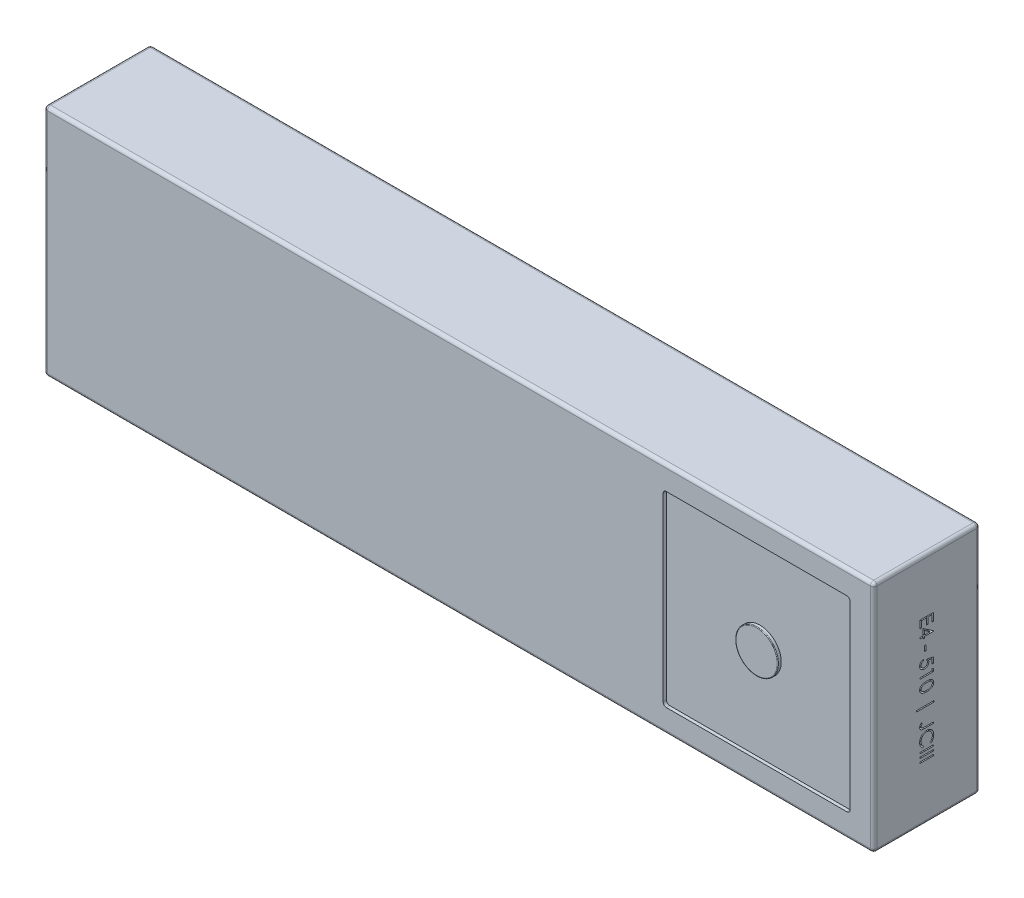
from build123d import *

# Parameters (mm, degrees)
SKETCH1_W           = 123.825
SKETCH1_H           = 34.925
BOSS_EXTRUDE1_DEPTH = 7.9375
FILLET1_R           = 0.5
SKETCH2_W           = 27.925
SKETCH2_H           = 27.925
CUT_EXTRUDE1_DEPTH  = 0.5
SKETCH3_R           = 3.175
BOSS_EXTRUDE2_DEPTH = 0.5
FILLET2_R           = 0.5
FILLET3_R           = 0.1
SKETCH4_W           = 0.205128205
SKETCH4_H           = 0.769230769
SKETCH4_W_2         = 2.58974359
SKETCH4_H_2         = 0.179487179
SKETCH4_W_3         = 2
SKETCH4_H_3         = 0.17948718
CUT_EXTRUDE2_DEPTH  = 1


with BuildPart() as part:
    # Sketch1 → Boss-Extrude1 (new, symmetric)
    with BuildSketch(Plane.XY):
        Rectangle(SKETCH1_W, SKETCH1_H)
    extrude(amount=BOSS_EXTRUDE1_DEPTH, both=True)

    # Fillet1
    fillet1_edges = [part.edges().sort_by_distance(p)[0] for p in [
        (-61.9125, 0, 7.9375),
        (0, -17.4625, 7.9375),
        (61.9125, 0, 7.9375),
        (0, -17.4625, -7.9375),
        (-61.9125, 0, -7.9375),
        (0, 17.4625, -7.9375),
        (61.9125, 0, -7.9375),
        (61.9125, -17.4625, 0),
        (-61.9125, -17.4625, 0),
        (-61.9125, 17.4625, 0),
        (61.9125, 17.4625, 0),
        (0, 17.4625, 7.9375),
    ]]
    fillet(fillet1_edges, radius=FILLET1_R)

    # Sketch2 → Cut-Extrude1 (cut)
    with BuildSketch(Plane.XY.offset(7.9375)):
        with Locations((44.45, 0)):
            Rectangle(SKETCH2_W, SKETCH2_H)
    extrude(amount=-CUT_EXTRUDE1_DEPTH, mode=Mode.SUBTRACT)

    # Sketch3 → Boss-Extrude2 (add)
    with BuildSketch(Plane.XY.offset(7.4375)):
        with Locations((44.45, 0)):
            Circle(SKETCH3_R)
    extrude(amount=BOSS_EXTRUDE2_DEPTH)

    # Fillet2
    fillet2_edges = [part.edges().sort_by_distance(p)[0] for p in [
        (58.4125, 13.9625, 7.6875),
        (58.4125, -13.9625, 7.6875),
        (30.4875, -13.9625, 7.6875),
        (30.4875, 13.9625, 7.6875),
    ]]
    fillet(fillet2_edges, radius=FILLET2_R)

    # Fillet3
    fillet3_edges = [part.edges().sort_by_distance(p)[0] for p in [
        (41.275, 0, 7.9375),
    ]]
    fillet(fillet3_edges, radius=FILLET3_R)

    # Sketch4 → Cut-Extrude2 (cut)
    # profile 1 of 12: a face of its own
    with BuildSketch(Plane(origin=(61.9125, 0, 0), x_dir=(0, 0, -1), z_dir=(1, 0, 0))):
        Polygon((0.988986137, 9.333333333), (0.988986137, 8.205128205), (0.783857931, 8.205128205), (0.783857931, 9.153846154), (0.168473316, 9.153846154), (0.168473316, 8.205128205), (-0.036654889, 8.205128205), (-0.036654889, 9.153846154), (-0.805885658, 9.153846154), (-0.805885658, 8.205128205), (-1.011013863, 8.205128205), (-1.011013863, 9.333333333), align=None)
    # profile 2 of 12: a face of its own
    with BuildSketch(Plane(origin=(61.9125, 0, 0), x_dir=(0, 0, -1), z_dir=(1, 0, 0))):
        Polygon((1.040268188, 6.933894231), (1.040268188, 6.897435897), (-0.344347197, 6.897435897), (-0.344347197, 6.666666667), (-0.549475402, 6.666666667), (-0.549475402, 6.897435897), (-1.011013863, 6.897435897), (-1.011013863, 7.076923077), (-0.549475402, 7.076923077), (-0.549475402, 8.025641026), align=None)
        Polygon((-0.344347197, 7.076923077), (0.524242547, 7.076923077), (-0.344347197, 7.673076923), align=None, mode=Mode.SUBTRACT)
    # profile 3 of 12: a face of its own
    with BuildSketch(Plane(origin=(61.9125, 0, 0), x_dir=(0, 0, -1), z_dir=(1, 0, 0))):
        with Locations((-0.241783095, 5.333333334)):
            Rectangle(SKETCH4_W, SKETCH4_H)
    # profile 4 of 12: a face of its own
    with BuildSketch(Plane(origin=(61.9125, 0, 0), x_dir=(0, 0, -1), z_dir=(1, 0, 0))):
        with BuildLine():
            Line((0.988986137, 2.769230769), (0.783857931, 2.769230769))
            Line((0.783857931, 2.769230769), (0.783857931, 3.449519231))
            Line((0.783857931, 3.449519231), (0.257816265, 3.557291667))
            add(Edge.make_bspline(
                [(0.257816265, 3.557291667), (0.263662134, 3.536116881), (0.274987582, 3.495094084), (0.287562308, 3.434545592), (0.295142562, 3.377064333), (0.296177596, 3.339764121), (0.296678444, 3.321714744)],
                knots=[0, 0, 0, 0, 1.100273476, 2.13160584, 3.095893838, 4, 4, 4, 4], degree=3))
            add(Edge.make_bspline(
                [(0.296678444, 3.321714744), (0.296194926, 3.299381255), (0.295244208, 3.255468037), (0.286119235, 3.191216115), (0.27174704, 3.12988701), (0.251701868, 3.071585506), (0.225903999, 3.016186028), (0.194095766, 2.963997951), (0.156497184, 2.914725508), (0.113471016, 2.869020059), (0.066059037, 2.827620389), (0.015248206, 2.791076771), (-0.039007694, 2.760684274), (-0.096468747, 2.735679911), (-0.157038541, 2.715841364), (-0.221165411, 2.702601029), (-0.288280291, 2.693794419), (-0.334168385, 2.69280979), (-0.357568351, 2.692307692)],
                knots=[0, 0, 0, 0, 1.052772836, 2.070014431, 3.053871312, 4.019926262, 4.972333346, 5.930471369, 6.896690565, 7.89035727, 8.885779078, 9.861050232, 10.836829716, 11.812751485, 12.812646763, 13.836748493, 14.896881366, 16, 16, 16, 16], degree=3))
            add(Edge.make_bspline(
                [(-0.357568351, 2.692307692), (-0.373866784, 2.692687684), (-0.40624339, 2.693442533), (-0.454325477, 2.697282476), (-0.501391119, 2.704671522), (-0.547439612, 2.714606238), (-0.592409391, 2.727449664), (-0.636284101, 2.743166409), (-0.679198838, 2.761692576), (-0.721156413, 2.782609059), (-0.760863342, 2.806805552), (-0.79893256, 2.832293734), (-0.83396304, 2.860527624), (-0.867233628, 2.890140277), (-0.897437736, 2.922315781), (-0.925867928, 2.956055461), (-0.951289255, 2.992151102), (-0.974671136, 3.029956458), (-0.995606365, 3.069447689), (-1.013070086, 3.111025229), (-1.028377187, 3.153776342), (-1.040825004, 3.198082064), (-1.05048271, 3.243856561), (-1.057059477, 3.291257461), (-1.061844647, 3.340046915), (-1.062144466, 3.373118283), (-1.062295915, 3.389823718)],
                knots=[0, 0, 0, 0, 1.05623316, 2.098192244, 3.122504159, 4.140841222, 5.148757784, 6.150489607, 7.158294732, 8.176043417, 9.185147859, 10.169157858, 11.142149047, 12.097904048, 13.0527185, 13.998867679, 14.954465986, 15.910220987, 16.877849176, 17.847023716, 18.829548819, 19.818454515, 20.826519638, 21.858115382, 22.918063636, 24, 24, 24, 24], degree=3))
            add(Edge.make_bspline(
                [(-1.062295915, 3.389823718), (-1.061901116, 3.409751797), (-1.061124395, 3.448957938), (-1.053000039, 3.50639861), (-1.041361715, 3.561662829), (-1.023861835, 3.614313228), (-1.001902032, 3.664794019), (-0.974324358, 3.712433206), (-0.942636356, 3.75816716), (-0.905744682, 3.800752886), (-0.865043564, 3.84019738), (-0.82134845, 3.876048998), (-0.774485602, 3.907490653), (-0.724853979, 3.934650655), (-0.672368182, 3.957784281), (-0.616871155, 3.975966509), (-0.558642079, 3.990639242), (-0.518554428, 3.996846996), (-0.498193351, 4)],
                knots=[0, 0, 0, 0, 1.046825758, 2.059506013, 3.044032586, 4.011925612, 4.970610144, 5.93275819, 6.900651216, 7.891265644, 8.889116719, 9.876966323, 10.858259055, 11.851035124, 12.847502422, 13.86866322, 14.9174643, 16, 16, 16, 16], degree=3))
            Line((-0.498193351, 4), (-0.498193351, 3.820512821))
            add(Edge.make_bspline(
                [(-0.498193351, 3.820512821), (-0.517267429, 3.816099281), (-0.553928866, 3.807616214), (-0.605408274, 3.78894737), (-0.651456097, 3.766261983), (-0.692115806, 3.738672926), (-0.727758373, 3.706428015), (-0.759795221, 3.6698973), (-0.788314786, 3.628560354), (-0.812240258, 3.582643529), (-0.832615064, 3.534172832), (-0.846189415, 3.483450331), (-0.855732272, 3.431847424), (-0.856687632, 3.396945555), (-0.85716771, 3.379407051)],
                knots=[0, 0, 0, 0, 1.136389429, 2.184203582, 3.172920998, 4.111012962, 5.028380909, 5.957351669, 6.927793475, 7.937618031, 8.960409703, 9.974842029, 10.982339866, 12, 12, 12, 12], degree=3))
            add(Edge.make_bspline(
                [(-0.85716771, 3.379407051), (-0.856698694, 3.36228794), (-0.855775197, 3.32858027), (-0.848667191, 3.278973764), (-0.837720007, 3.231080693), (-0.821337233, 3.185373632), (-0.801425965, 3.141052752), (-0.775874493, 3.099239169), (-0.746468768, 3.058723239), (-0.712779265, 3.020764306), (-0.675653726, 2.985998906), (-0.635952358, 2.955281123), (-0.593599874, 2.929694315), (-0.549329501, 2.908131967), (-0.50265604, 2.891758653), (-0.453798225, 2.880078093), (-0.40263538, 2.873219202), (-0.367738631, 2.87227567), (-0.349956171, 2.871794872)],
                knots=[0, 0, 0, 0, 1.027316725, 2.022795036, 3.002884548, 3.971462791, 4.93288096, 5.914575861, 6.907176829, 7.935150275, 8.956128384, 9.956726525, 10.942570165, 11.921478529, 12.907843606, 13.90538589, 14.932640048, 16, 16, 16, 16], degree=3))
            add(Edge.make_bspline(
                [(-0.349956171, 2.871794872), (-0.333903218, 2.87211054), (-0.302463838, 2.872728771), (-0.256670028, 2.879598827), (-0.21302586, 2.889222709), (-0.17192163, 2.903998953), (-0.132755426, 2.922256256), (-0.096365548, 2.945419161), (-0.061817077, 2.971896748), (-0.03051353, 3.002909326), (-0.00142681, 3.036727224), (0.023332475, 3.07413547), (0.044171364, 3.114280811), (0.062152424, 3.156698605), (0.075067318, 3.202392587), (0.084763201, 3.250459304), (0.090371994, 3.301417403), (0.091150214, 3.336257799), (0.091550239, 3.354166667)],
                knots=[0, 0, 0, 0, 1.045726679, 2.048034203, 3.01323695, 3.95502507, 4.889743367, 5.8246644, 6.761650845, 7.722168973, 8.692072792, 9.66525385, 10.638902184, 11.638179751, 12.663148338, 13.728659964, 14.832472288, 16, 16, 16, 16], degree=3))
            add(Edge.make_bspline(
                [(0.091550239, 3.354166667), (0.091229739, 3.369803537), (0.090573625, 3.401814638), (0.085410143, 3.451031651), (0.077466623, 3.502526279), (0.066017475, 3.556498442), (0.051682354, 3.612800022), (0.033779586, 3.671524649), (0.013157854, 3.732673742), (-0.002837064, 3.773831461), (-0.011013863, 3.794871795)],
                knots=[0, 0, 0, 0, 0.824638674, 1.688163388, 2.607705698, 3.571998603, 4.597075385, 5.671199175, 6.809488238, 8, 8, 8, 8], degree=3))
            Line((-0.011013863, 3.794871795), (0.988986137, 3.58974359))
            Line((0.988986137, 3.58974359), (0.988986137, 2.769230769))
        make_face()
    # profile 5 of 12: a face of its own
    with BuildSketch(Plane(origin=(61.9125, 0, 0), x_dir=(0, 0, -1), z_dir=(1, 0, 0))):
        Polygon((0.988986137, 2.062099359), (0.988986137, 1.692307692), (-1.011013863, 1.692307692), (-1.011013863, 1.871794872), (0.783857931, 1.871794872), (0.783857931, 2.179487179), align=None)
    # profile 6 of 12: a face of its own
    with BuildSketch(Plane(origin=(61.9125, 0, 0), x_dir=(0, 0, -1), z_dir=(1, 0, 0))):
        with BuildLine():
            add(Edge.make_bspline(
                [(-0.011815145, 0.948717949), (0.020240505, 0.94853051), (0.082509067, 0.948166407), (0.173243148, 0.944115881), (0.258363314, 0.937387114), (0.337873636, 0.928165757), (0.411794649, 0.916944059), (0.47992878, 0.901963764), (0.542591463, 0.884927932), (0.59998675, 0.865183491), (0.652888879, 0.842905395), (0.702272645, 0.81865499), (0.748075352, 0.791483107), (0.790985077, 0.762896272), (0.830522928, 0.731849846), (0.866614029, 0.698671292), (0.899280175, 0.663031492), (0.928910146, 0.62563532), (0.954721628, 0.586246443), (0.977979489, 0.546079089), (0.997068637, 0.504424472), (1.012753792, 0.461662496), (1.025321908, 0.417917516), (1.034025305, 0.373008782), (1.039479994, 0.326925445), (1.040002964, 0.295822117), (1.040268188, 0.280048077)],
                knots=[0, 0, 0, 0, 1.646377244, 3.198111528, 4.663803227, 6.031090796, 7.308794487, 8.502186765, 9.612154809, 10.642545331, 11.617106989, 12.558866172, 13.465886467, 14.35053239, 15.20542558, 16.045215227, 16.865619885, 17.686225247, 18.492864914, 19.282407821, 20.068097601, 20.842842034, 21.620163247, 22.403093475, 23.190129512, 24, 24, 24, 24], degree=3))
            add(Edge.make_bspline(
                [(1.040268188, 0.280048077), (1.039989436, 0.264142089), (1.039435087, 0.232510084), (1.03410712, 0.185744155), (1.025266478, 0.140058623), (1.012740207, 0.095648258), (0.99719982, 0.052148266), (0.977721468, 0.00989889), (0.955047829, -0.0313623), (0.928405614, -0.070979607), (0.898701456, -0.109387958), (0.865122788, -0.145643937), (0.828008663, -0.179750843), (0.787756169, -0.212136732), (0.743593263, -0.241882788), (0.696288058, -0.270210463), (0.645013278, -0.295565912), (0.590624439, -0.319985727), (0.531616634, -0.341064005), (0.468322485, -0.360073288), (0.399994379, -0.375432699), (0.32699081, -0.388226568), (0.249043676, -0.398137938), (0.166320068, -0.40535659), (0.078765559, -0.409169782), (0.018903931, -0.409887897), (-0.011815145, -0.41025641)],
                knots=[0, 0, 0, 0, 0.810914788, 1.612654377, 2.396697861, 3.181598691, 3.963628158, 4.749916497, 5.551656086, 6.361998678, 7.18212741, 8.025565596, 8.878627764, 9.750805457, 10.657531673, 11.591944965, 12.560506719, 13.57287815, 14.630710178, 15.753379473, 16.941251878, 18.199788006, 19.531962791, 20.947069417, 22.433333509, 24, 24, 24, 24], degree=3))
            add(Edge.make_bspline(
                [(-0.011815145, -0.41025641), (-0.042400121, -0.409883616), (-0.1019937, -0.409157242), (-0.189155837, -0.405404339), (-0.271434882, -0.39797707), (-0.349059869, -0.38879071), (-0.421569914, -0.375704868), (-0.489654498, -0.360828571), (-0.552726063, -0.342338932), (-0.611422666, -0.321547951), (-0.665545034, -0.297658023), (-0.716376568, -0.272078478), (-0.763643174, -0.243924684), (-0.807805438, -0.21400123), (-0.848407025, -0.181890617), (-0.885548282, -0.147639288), (-0.919204709, -0.111221172), (-0.949314719, -0.072725984), (-0.9756468, -0.03248544), (-0.999183446, 0.008638024), (-1.018281974, 0.051465198), (-1.034407232, 0.095044282), (-1.04696232, 0.139786472), (-1.055558704, 0.185647883), (-1.061604386, 0.23247832), (-1.062064607, 0.264136586), (-1.062295915, 0.280048077)],
                knots=[0, 0, 0, 0, 1.56130642, 3.042141888, 4.451772327, 5.777565838, 7.030558081, 8.211376819, 9.333164717, 10.383253789, 11.387583522, 12.350962576, 13.286244149, 14.193812918, 15.072134482, 15.925989337, 16.770211267, 17.600669898, 18.417446232, 19.22325363, 20.01647746, 20.807971184, 21.593601364, 22.38506573, 23.188331689, 24, 24, 24, 24], degree=3))
            add(Edge.make_bspline(
                [(-1.062295915, 0.280048077), (-1.062028139, 0.295821476), (-1.061500137, 0.32692354), (-1.056082311, 0.373016134), (-1.047247664, 0.417854828), (-1.035250256, 0.461529259), (-1.020002263, 0.504128806), (-1.00060738, 0.545236166), (-0.978112333, 0.585394226), (-0.952520007, 0.624419742), (-0.923191869, 0.661568912), (-0.890755818, 0.697054578), (-0.854398294, 0.729980742), (-0.814701254, 0.760638058), (-0.772001528, 0.789730186), (-0.72587849, 0.816635804), (-0.676032028, 0.840838907), (-0.622837862, 0.863616275), (-0.565020749, 0.883694481), (-0.502023849, 0.901296177), (-0.433498678, 0.915969652), (-0.359648667, 0.927770137), (-0.280418543, 0.937498449), (-0.195668804, 0.944084019), (-0.105472572, 0.948169633), (-0.043603984, 0.948531841), (-0.011815145, 0.948717949)],
                knots=[0, 0, 0, 0, 0.810940842, 1.599017053, 2.38298203, 3.159479784, 3.926441347, 4.70693857, 5.494146311, 6.292334103, 7.104379492, 7.925868426, 8.762126819, 9.623561095, 10.503686106, 11.41783325, 12.366995289, 13.351843594, 14.392337808, 15.512229747, 16.713911458, 17.994391108, 19.357476964, 20.818259213, 22.365182633, 24, 24, 24, 24], degree=3))
        make_face()
        with BuildLine():
            add(Edge.make_bspline(
                [(-0.011013863, 0.769230769), (-0.037727406, 0.769162514), (-0.089573146, 0.769030043), (-0.164912152, 0.765569357), (-0.235180911, 0.760854939), (-0.300468645, 0.754774196), (-0.360554371, 0.745743946), (-0.415851317, 0.735625763), (-0.466066934, 0.723312628), (-0.51154551, 0.708743853), (-0.553059852, 0.69215074), (-0.591687059, 0.67403081), (-0.627895453, 0.654575658), (-0.661317275, 0.63276437), (-0.692285216, 0.609091672), (-0.720710283, 0.583518693), (-0.746468451, 0.556090407), (-0.777033014, 0.518120669), (-0.808991019, 0.468240401), (-0.836477343, 0.405070781), (-0.853862531, 0.340132846), (-0.856067261, 0.296044381), (-0.85716771, 0.274038462)],
                knots=[0, 0, 0, 0, 1.459116078, 2.831857795, 4.118796693, 5.306371758, 6.412361096, 7.436813035, 8.376339383, 9.234574298, 10.043323891, 10.816788787, 11.564361537, 12.286735248, 12.994408768, 13.691741332, 14.372975427, 15.047457468, 16.352811911, 17.594285292, 18.799233213, 20, 20, 20, 20], degree=3))
            add(Edge.make_bspline(
                [(-0.85716771, 0.274038462), (-0.856254692, 0.251891221), (-0.854430542, 0.207642464), (-0.836831263, 0.142994582), (-0.810277241, 0.080234427), (-0.778878666, 0.031050461), (-0.748976764, -0.006368135), (-0.723482679, -0.033177844), (-0.694936469, -0.057784728), (-0.664136871, -0.081123057), (-0.630495452, -0.102528243), (-0.59417398, -0.121992893), (-0.555071593, -0.139754806), (-0.527774599, -0.149874261), (-0.513818351, -0.155048077)],
                knots=[0, 0, 0, 0, 1.353760809, 2.704726607, 4.075137775, 5.516104923, 6.260822281, 7.007110065, 7.778089737, 8.566572457, 9.372053459, 10.217411131, 11.088608312, 12, 12, 12, 12], degree=3))
            add(Edge.make_bspline(
                [(-0.513818351, -0.155048077), (-0.495972785, -0.161077659), (-0.459738634, -0.173320295), (-0.403530833, -0.189098452), (-0.344557825, -0.201524394), (-0.283172044, -0.21270346), (-0.218920786, -0.220333778), (-0.152002853, -0.226475386), (-0.082367789, -0.230092921), (-0.035056365, -0.23054135), (-0.011013863, -0.230769231)],
                knots=[0, 0, 0, 0, 0.884706709, 1.796334032, 2.740027952, 3.714592787, 4.726048262, 5.777819803, 6.87074269, 8, 8, 8, 8], degree=3))
            add(Edge.make_bspline(
                [(-0.011013863, -0.230769231), (0.013028121, -0.230517903), (0.060065201, -0.230026191), (0.128880491, -0.226795597), (0.194354401, -0.221604303), (0.256546326, -0.214577999), (0.315345572, -0.20493237), (0.37083628, -0.193348929), (0.423003491, -0.179768675), (0.471981738, -0.164191717), (0.517594982, -0.146636702), (0.559942531, -0.127243674), (0.599248886, -0.106548686), (0.635401224, -0.084066613), (0.668562727, -0.06006928), (0.698068197, -0.033922058), (0.724832182, -0.006662429), (0.755382221, 0.031518824), (0.786531761, 0.08150413), (0.81519791, 0.143701644), (0.831659791, 0.208427726), (0.833980755, 0.252183986), (0.835139983, 0.274038462)],
                knots=[0, 0, 0, 0, 1.313668642, 2.570134578, 3.763346207, 4.902004944, 5.98888779, 7.017888835, 7.998425394, 8.933058446, 9.82474457, 10.667209444, 11.476765193, 12.250262638, 12.991704352, 13.7104269, 14.401925311, 15.076585796, 16.378385137, 17.609787933, 18.806186071, 20, 20, 20, 20], degree=3))
            add(Edge.make_bspline(
                [(0.835139983, 0.274038462), (0.833980652, 0.296159729), (0.831659877, 0.340442563), (0.815241077, 0.405827324), (0.78679865, 0.468467899), (0.755181067, 0.518052178), (0.725373004, 0.556185259), (0.699451799, 0.583112537), (0.670940741, 0.608286739), (0.64010391, 0.631979159), (0.606665232, 0.65376945), (0.570462104, 0.673232564), (0.531831307, 0.691342093), (0.49032641, 0.707970831), (0.444779272, 0.72240459), (0.394817089, 0.735305709), (0.339468493, 0.745417753), (0.279214784, 0.75424195), (0.213846791, 0.760969901), (0.143416028, 0.765557255), (0.067946737, 0.769036305), (0.015833495, 0.76916465), (-0.011013863, 0.769230769)],
                knots=[0, 0, 0, 0, 1.207964612, 2.418129846, 3.655795183, 4.951004962, 5.620895151, 6.296795572, 6.989224116, 7.696855977, 8.419187164, 9.166715907, 9.940135271, 10.748837255, 11.607021648, 12.548275234, 13.5654991, 14.678641405, 15.874140913, 17.15372626, 18.533675393, 20, 20, 20, 20], degree=3))
        make_face(mode=Mode.SUBTRACT)
    # profile 7 of 12: a face of its own
    with BuildSketch(Plane(origin=(61.9125, 0, 0), x_dir=(0, 0, -1), z_dir=(1, 0, 0))):
        with Locations((-0.254603607, -2.192307693)):
            Rectangle(SKETCH4_W_2, SKETCH4_H_2)
    # profile 8 of 12: a face of its own
    with BuildSketch(Plane(origin=(61.9125, 0, 0), x_dir=(0, 0, -1), z_dir=(1, 0, 0))):
        with BuildLine():
            Line((0.988986137, -4.820512821), (0.988986137, -5))
            Line((0.988986137, -5), (-0.361574761, -5))
            add(Edge.make_bspline(
                [(-0.361574761, -5), (-0.386549339, -4.999822127), (-0.434503578, -4.99948059), (-0.503571805, -4.997566764), (-0.566649334, -4.99412817), (-0.623815286, -4.988810649), (-0.675059516, -4.982684243), (-0.720552475, -4.974736605), (-0.760068233, -4.965339194), (-0.80441841, -4.951103708), (-0.853219088, -4.92789131), (-0.905502207, -4.892301138), (-0.951609145, -4.848820782), (-0.991500093, -4.798326393), (-1.023311114, -4.740541665), (-1.046140722, -4.676596995), (-1.060067465, -4.606902596), (-1.061538191, -4.558560077), (-1.062295915, -4.533653846)],
                knots=[0, 0, 0, 0, 1.237549021, 2.376245131, 3.423509879, 4.367128923, 5.220764738, 5.980167839, 6.654279555, 7.23186528, 8.285695362, 9.319068926, 10.353713031, 11.414109097, 12.495220016, 13.606748513, 14.766988686, 16, 16, 16, 16], degree=3))
            add(Edge.make_bspline(
                [(-1.062295915, -4.533653846), (-1.06169832, -4.514112284), (-1.060504082, -4.475060261), (-1.050179979, -4.416860767), (-1.034871144, -4.358961941), (-1.011722394, -4.300977898), (-0.980771568, -4.24168225), (-0.940069607, -4.180220271), (-0.889887841, -4.115861366), (-0.851579421, -4.073471331), (-0.831526684, -4.051282051)],
                knots=[0, 0, 0, 0, 0.854372818, 1.707385869, 2.579105618, 3.471016644, 4.432770875, 5.500780854, 6.691771033, 8, 8, 8, 8], degree=3))
            Line((-0.831526684, -4.051282051), (-0.67768053, -4.157051282))
            add(Edge.make_bspline(
                [(-0.67768053, -4.157051282), (-0.694476337, -4.181471637), (-0.72612453, -4.227486699), (-0.767394923, -4.294966798), (-0.802084906, -4.355170199), (-0.820033666, -4.394499733), (-0.828321556, -4.412660256)],
                knots=[0, 0, 0, 0, 1.196704426, 2.25493972, 3.19421351, 4, 4, 4, 4], degree=3))
            add(Edge.make_bspline(
                [(-0.828321556, -4.412660256), (-0.832641246, -4.423679863), (-0.841113119, -4.445291765), (-0.850567919, -4.478334668), (-0.85573501, -4.511188975), (-0.856695772, -4.532970514), (-0.85716771, -4.543669872)],
                knots=[0, 0, 0, 0, 1.051806502, 2.062826769, 3.048436908, 4, 4, 4, 4], degree=3))
            add(Edge.make_bspline(
                [(-0.85716771, -4.543669872), (-0.85660165, -4.557493727), (-0.85548808, -4.58468846), (-0.845064687, -4.624307119), (-0.829782703, -4.662389674), (-0.806851174, -4.69736661), (-0.779761767, -4.729524782), (-0.746999672, -4.756106718), (-0.710567131, -4.778085484), (-0.676355888, -4.791975533), (-0.644911629, -4.800352467), (-0.616139315, -4.805900948), (-0.582368613, -4.809916429), (-0.543812173, -4.814242785), (-0.500205429, -4.816573272), (-0.451749073, -4.819291433), (-0.398303594, -4.820259016), (-0.361040334, -4.820425638), (-0.34154271, -4.820512821)],
                knots=[0, 0, 0, 0, 0.99710849, 1.961544003, 2.943780681, 3.950512064, 4.9701611, 5.971139155, 6.984143068, 8.036211364, 8.626223178, 9.334153146, 10.151809154, 11.083375733, 12.13756692, 13.306844995, 14.590833851, 16, 16, 16, 16], degree=3))
            Line((-0.34154271, -4.820512821), (0.988986137, -4.820512821))
        make_face()
    # profile 9 of 12: a face of its own
    with BuildSketch(Plane(origin=(61.9125, 0, 0), x_dir=(0, 0, -1), z_dir=(1, 0, 0))):
        with BuildLine():
            Line((0.621998957, -7.358974359), (0.501806649, -7.201923077))
            add(Edge.make_bspline(
                [(0.501806649, -7.201923077), (0.515158632, -7.190719712), (0.541682584, -7.168464028), (0.578928038, -7.13265877), (0.613822473, -7.095343545), (0.646532119, -7.056532619), (0.675913128, -7.015527408), (0.703496615, -6.973321237), (0.728221037, -6.929208068), (0.758199886, -6.868207077), (0.789483403, -6.788408307), (0.815713821, -6.687954113), (0.832411636, -6.583090628), (0.834220116, -6.511549142), (0.835139983, -6.475160256)],
                knots=[0, 0, 0, 0, 0.757959112, 1.505699292, 2.245454638, 2.979532153, 3.711538275, 4.438200793, 5.171680507, 5.909471876, 7.393775596, 8.890124382, 10.418191784, 12, 12, 12, 12], degree=3))
            add(Edge.make_bspline(
                [(0.835139983, -6.475160256), (0.834908105, -6.4551129), (0.834446503, -6.415204247), (0.828399517, -6.355972952), (0.819802525, -6.297735504), (0.807356594, -6.240708469), (0.791153121, -6.185005076), (0.772150772, -6.130201191), (0.748504277, -6.076942256), (0.72238988, -6.024587314), (0.692885412, -5.97443008), (0.660713832, -5.926962665), (0.626190901, -5.882401923), (0.589405733, -5.840624376), (0.549901162, -5.802088206), (0.508141913, -5.766175812), (0.46362536, -5.73353442), (0.417186376, -5.703361926), (0.368756702, -5.676513802), (0.318641003, -5.653329147), (0.267030888, -5.633457971), (0.213820632, -5.617588627), (0.159219629, -5.605071485), (0.103112004, -5.596424074), (0.045606664, -5.590431486), (0.006629966, -5.58997413), (-0.013017069, -5.58974359)],
                knots=[0, 0, 0, 0, 1.055000685, 2.100209969, 3.131349012, 4.153242145, 5.170189196, 6.184191144, 7.204341339, 8.235672124, 9.263040994, 10.265373269, 11.252624173, 12.22887325, 13.193405896, 14.155809299, 15.126090485, 16.097288279, 17.069732292, 18.038585918, 19.002221264, 19.978698174, 20.959418239, 21.948869816, 22.966084182, 24, 24, 24, 24], degree=3))
            add(Edge.make_bspline(
                [(-0.013017069, -5.58974359), (-0.042577823, -5.590464629), (-0.100616443, -5.591880294), (-0.18562822, -5.604479343), (-0.267068605, -5.623625109), (-0.344428515, -5.652319724), (-0.418661863, -5.687702039), (-0.488512636, -5.73241096), (-0.555036387, -5.784191838), (-0.616660929, -5.843777221), (-0.672954486, -5.909151973), (-0.722526247, -5.979293637), (-0.763849037, -6.054027515), (-0.798235292, -6.132528447), (-0.824667708, -6.215400512), (-0.843275778, -6.302494685), (-0.855414167, -6.393621539), (-0.856576275, -6.455889768), (-0.85716771, -6.487580128)],
                knots=[0, 0, 0, 0, 1.029171465, 2.020641659, 2.987623507, 3.938342917, 4.889210282, 5.84687017, 6.821220943, 7.821438502, 8.827599549, 9.822697543, 10.807740252, 11.797342354, 12.80366471, 13.83203677, 14.896651826, 16, 16, 16, 16], degree=3))
            add(Edge.make_bspline(
                [(-0.85716771, -6.487580128), (-0.856202693, -6.52249595), (-0.854303308, -6.591218641), (-0.838212309, -6.692000371), (-0.81212207, -6.788477951), (-0.775608972, -6.880656572), (-0.728143093, -6.96827637), (-0.670601449, -7.051474461), (-0.602436687, -7.130321073), (-0.550389185, -7.177733234), (-0.523834376, -7.201923077)],
                knots=[0, 0, 0, 0, 1.028121516, 2.023589091, 2.998037872, 3.967518031, 4.937445131, 5.927275754, 6.942489185, 8, 8, 8, 8], degree=3))
            Line((-0.523834376, -7.201923077), (-0.642824761, -7.358974359))
            add(Edge.make_bspline(
                [(-0.642824761, -7.358974359), (-0.659132476, -7.346335456), (-0.691669792, -7.321118189), (-0.737538927, -7.280284788), (-0.780685634, -7.237270119), (-0.820752815, -7.191749112), (-0.858576911, -7.144266198), (-0.892889902, -7.09398499), (-0.924737015, -7.041773942), (-0.953512121, -6.987329074), (-0.979312161, -6.930829134), (-1.001093268, -6.872332922), (-1.020125893, -6.812336021), (-1.035680303, -6.750808216), (-1.047840142, -6.687543959), (-1.055964316, -6.622760312), (-1.06153149, -6.556320523), (-1.062038821, -6.511496835), (-1.062295915, -6.488782051)],
                knots=[0, 0, 0, 0, 0.986756325, 1.968786143, 2.935506311, 3.899499537, 4.868307269, 5.8376204, 6.809456583, 7.792545619, 8.781780509, 9.778496008, 10.776623214, 11.79151764, 12.812666265, 13.856269958, 14.913646641, 16, 16, 16, 16], degree=3))
            add(Edge.make_bspline(
                [(-1.062295915, -6.488782051), (-1.062146205, -6.467271384), (-1.061850172, -6.424736704), (-1.057054647, -6.361937418), (-1.050511941, -6.300800514), (-1.040660437, -6.241500728), (-1.0290351, -6.183714457), (-1.013451525, -6.127965551), (-0.995994858, -6.073705431), (-0.975477723, -6.021152094), (-0.952325619, -5.970260837), (-0.926159013, -5.921195801), (-0.897197948, -5.873979554), (-0.866080799, -5.828147885), (-0.831808055, -5.784377837), (-0.794855693, -5.742290109), (-0.755348258, -5.701648694), (-0.72685977, -5.676504302), (-0.712536299, -5.663862179)],
                knots=[0, 0, 0, 0, 1.114604814, 2.203992996, 3.262667896, 4.300477797, 5.318619304, 6.316056647, 7.298880507, 8.271930387, 9.238335007, 10.195173496, 11.151986948, 12.108099108, 13.064862484, 14.031167946, 15.010108607, 16, 16, 16, 16], degree=3))
            add(Edge.make_bspline(
                [(-0.712536299, -5.663862179), (-0.68765562, -5.64361324), (-0.638194643, -5.603359825), (-0.558031225, -5.551859434), (-0.474335105, -5.507775117), (-0.386666575, -5.472131734), (-0.295222353, -5.444267315), (-0.199956345, -5.424963775), (-0.100957521, -5.412420001), (-0.033622213, -5.41098555), (0.000604726, -5.41025641)],
                knots=[0, 0, 0, 0, 0.994628077, 1.977248131, 2.950237994, 3.925870899, 4.908910175, 5.911660606, 6.938484602, 8, 8, 8, 8], degree=3))
            add(Edge.make_bspline(
                [(0.000604726, -5.41025641), (0.036577766, -5.411149067), (0.107352476, -5.412905314), (0.211244788, -5.427703323), (0.310637741, -5.45179734), (0.405913775, -5.484974962), (0.496527756, -5.528745116), (0.582862387, -5.581732427), (0.664847171, -5.644454453), (0.741433926, -5.716123466), (0.811454548, -5.794737514), (0.87305858, -5.87891861), (0.924325604, -5.96850858), (0.967180588, -6.062518704), (1.000120272, -6.1616534), (1.023179239, -6.265701034), (1.037531876, -6.37446613), (1.03934628, -6.44867323), (1.040268188, -6.486378205)],
                knots=[0, 0, 0, 0, 1.032901378, 2.032168977, 3.007206631, 3.966850309, 4.924221947, 5.891988639, 6.871730993, 7.884084801, 8.900290346, 9.89161143, 10.874607481, 11.860025555, 12.854717796, 13.869097222, 14.917278314, 16, 16, 16, 16], degree=3))
            add(Edge.make_bspline(
                [(1.040268188, -6.486378205), (1.039992886, -6.509357948), (1.039447954, -6.554844036), (1.034127174, -6.622130613), (1.025273228, -6.687642914), (1.013142724, -6.75153937), (0.998274791, -6.814051684), (0.978811519, -6.874538525), (0.956209888, -6.933329267), (0.930842799, -6.990467942), (0.901842405, -7.045332898), (0.870344936, -7.09791415), (0.835623327, -7.147577401), (0.798825474, -7.195256821), (0.758574897, -7.239878995), (0.716182386, -7.282718321), (0.670390008, -7.322294967), (0.638158835, -7.346725514), (0.621998957, -7.358974359)],
                knots=[0, 0, 0, 0, 1.096705196, 2.170817488, 3.219277236, 4.250701065, 5.274195539, 6.284202015, 7.28098643, 8.279664616, 9.266225751, 10.241373748, 11.203306326, 12.157093976, 13.114198862, 14.069774147, 15.032234603, 16, 16, 16, 16], degree=3))
        make_face()
    # profile 10 of 12: a face of its own
    with BuildSketch(Plane(origin=(61.9125, 0, 0), x_dir=(0, 0, -1), z_dir=(1, 0, 0))):
        with Locations((-0.011013863, -7.858974359)):
            Rectangle(SKETCH4_W_3, SKETCH4_H_3)
    # profile 11 of 12: a face of its own
    with BuildSketch(Plane(origin=(61.9125, 0, 0), x_dir=(0, 0, -1), z_dir=(1, 0, 0))):
        with Locations((-0.011013863, -8.474358974)):
            Rectangle(SKETCH4_W_3, SKETCH4_H_2)
    # profile 12 of 12: a face of its own
    with BuildSketch(Plane(origin=(61.9125, 0, 0), x_dir=(0, 0, -1), z_dir=(1, 0, 0))):
        with Locations((-0.011013863, -9.089743589)):
            Rectangle(SKETCH4_W_3, SKETCH4_H_2)
    extrude(amount=-CUT_EXTRUDE2_DEPTH, mode=Mode.SUBTRACT)


solid = part.part
